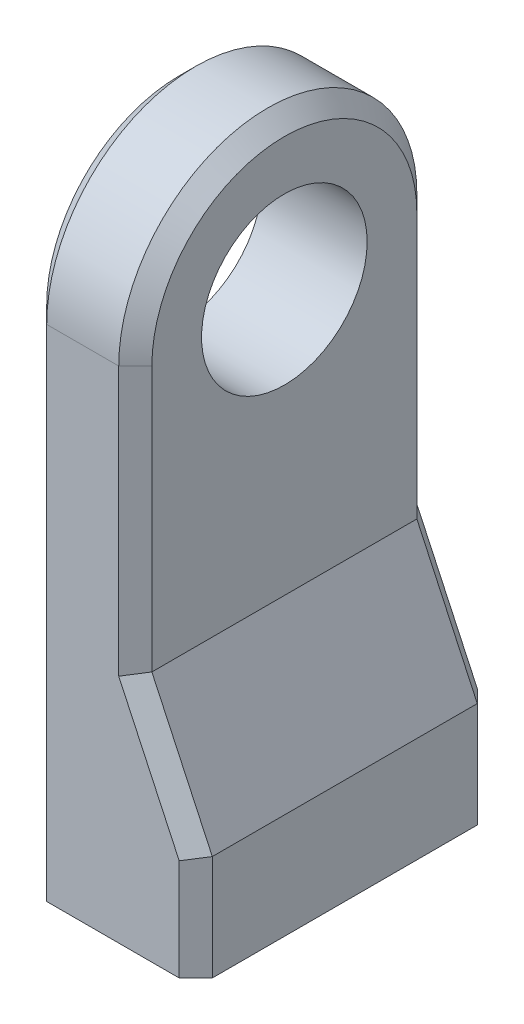
from build123d import *

# Parameters (mm, degrees)
SKETCH1_R           = 5
BOSS_EXTRUDE1_DEPTH = 10
SKETCH2_R           = 2
CUT_EXTRUDE1_DEPTH  = 10
CUT_EXTRUDE2_DEPTH  = 24
CHAMFER1_SIZE       = 1


with BuildPart() as part:
    # Sketch1 → Boss-Extrude1 (new body)
    with BuildSketch(Plane(origin=(0, 0, 0), x_dir=(0, 0, -1), z_dir=(1, 0, 0))):
        with BuildLine():
            Line((-18, 30.175), (-18, 0))
            Line((-18, 0), (0, 0))
            Line((0, 0), (0, 30.175))
            ThreePointArc((0, 30.175), (-9, 39.175), (-18, 30.175))
        make_face()
        with Locations((-9, 30.175)):
            Circle(SKETCH1_R, mode=Mode.SUBTRACT)
    extrude(amount=BOSS_EXTRUDE1_DEPTH)

    # Sketch2 → Cut-Extrude1 (cut)
    with BuildSketch(Plane.XZ):
        with Locations(Location((5, 4, 0), (0, 0, 270))):
            Circle(SKETCH2_R)
        with Locations(Location((5, 14, 0), (0, 0, 270))):
            Circle(SKETCH2_R)
    extrude(amount=-CUT_EXTRUDE1_DEPTH, mode=Mode.SUBTRACT)

    # Sketch3 → Cut-Extrude2 (cut)
    with BuildSketch(Plane.XY):
        Polygon((10, 6.35), (6.35, 14.17745026), (6.35, 39.175), (10, 39.175), align=None)
    extrude(amount=CUT_EXTRUDE2_DEPTH, mode=Mode.SUBTRACT)

    # Chamfer1
    chamfer1_edges = [part.edges().sort_by_distance(p)[0] for p in [
        (10, 3.175, 0),
        (10, 3.175, 18),
        (8.175, 10.26372513, 0),
        (6.35, 22.17622513, 0),
        (6.35, 39.175, 9),
        (6.35, 22.17622513, 18),
        (8.175, 10.26372513, 18),
        (0, 15.0875, 0),
        (0, 15.0875, 18),
        (0, 39.175, 9),
    ]]
    chamfer(chamfer1_edges, length=CHAMFER1_SIZE)


solid = part.part
